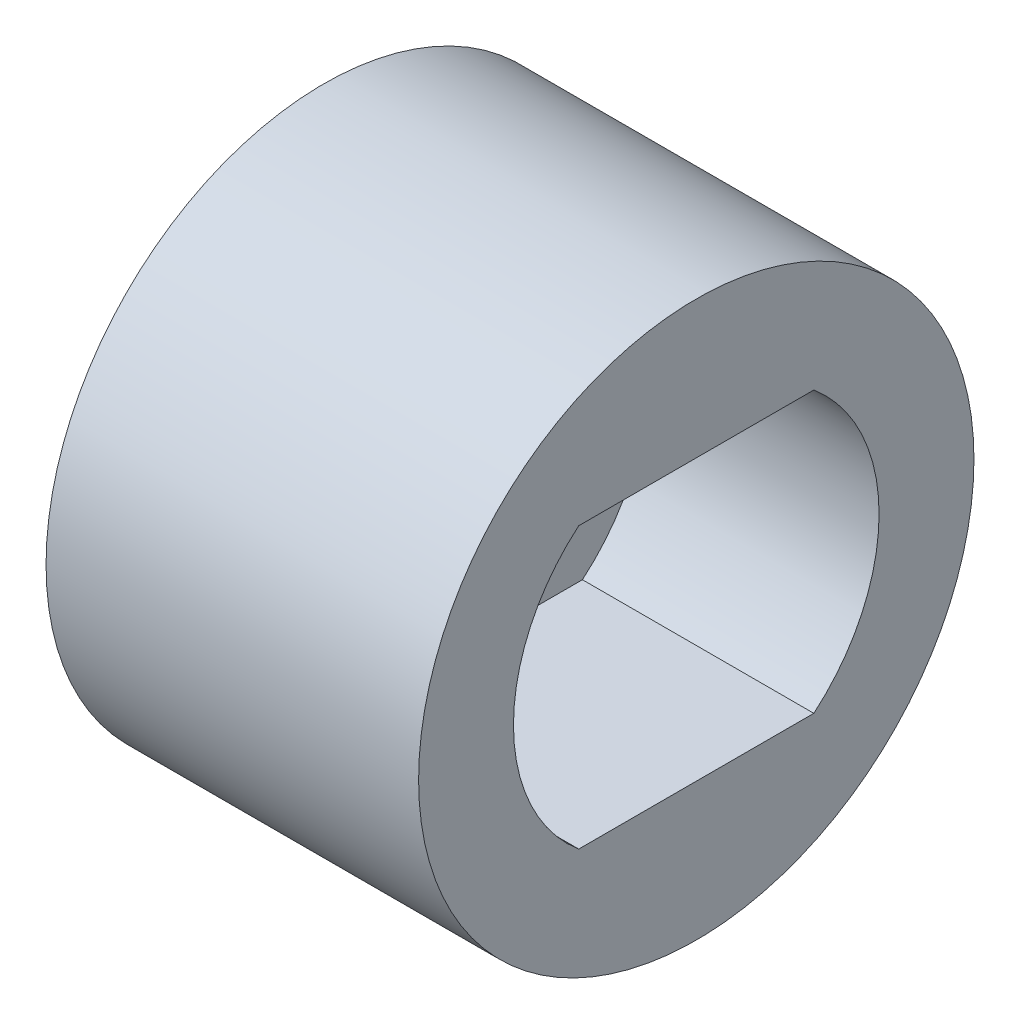
from build123d import *

# Parameters (mm, degrees)
BASPROSKE_W         = 5.1
BASPROSKE_H         = 2.25
TOOTHCUT_DEPTH      = 18.720327311
TEETHCUTS_COUNT     = 41
TEETHCUTS_ANGLE     = 351.219512195
EXTRUDE_START       = 11
SKETCH_1_R          = 12
SKETCH_1_R_2        = 2.5
EXTRUDE_1_DEPTH     = 11
CUT_EXTRUDE_1_REACH = 23.224
CUT_EXTRUDE_START   = 1
SKETCH_1_3_R        = 2.5


with BuildPart() as part:
    # BasProSke → Base-Revolve (revolve)
    with BuildSketch(Plane(origin=(0, 0, 0), x_dir=(1, 0, 0), z_dir=(0, 1, 0))):
        with Locations((2.55, 10.875)):
            Rectangle(BASPROSKE_W, BASPROSKE_H)
    revolve(axis=Axis((-10, 0, 0), (1, 0, 0)))

    # TooCutSke → ToothCut (cut, through all)
    with BuildSketch(Plane(origin=(0, 0, 0), x_dir=(0, 0, -1), z_dir=(1, 0, 0))):
        with BuildLine():
            ThreePointArc((0.61773312, 9.704960121), (0.414250651, 10.304883928), (0.13830881, 10.875120536))
            ThreePointArc((0.13830881, 10.875120536), (0, 10.876), (-0.13830881, 10.875120536))
            ThreePointArc((-0.13830881, 10.875120536), (-0.414250651, 10.304883928), (-0.61773312, 9.704960121))
            ThreePointArc((-0.61773312, 9.704960121), (0, 9.7246), (0.61773312, 9.704960121))
        make_face()
    toothcut = extrude(amount=TOOTHCUT_DEPTH, mode=Mode.SUBTRACT)

    # TeethCuts: ToothCut ×41 about axis
    teethcuts_axis = Axis((-10, 0, 0), (1, 0, 0))
    for i in range(1, TEETHCUTS_COUNT):
        add(toothcut.rotate(teethcuts_axis, i * TEETHCUTS_ANGLE / (TEETHCUTS_COUNT - 1)), mode=Mode.SUBTRACT)

    # 草图1 → 凸台-拉伸1 (add)
    with BuildSketch(Plane(origin=(5.1, 0, 0), x_dir=(0, 0, -1), z_dir=(1, 0, 0)).offset(EXTRUDE_START)):
        Circle(SKETCH_1_R)
        Circle(SKETCH_1_R_2, mode=Mode.SUBTRACT)
    extrude(amount=-EXTRUDE_1_DEPTH)

    # 草图1<3> → 切除-拉伸1 (cut, up to next)
    with BuildSketch(Plane(origin=(5.1, 0, 0), x_dir=(0, 0, -1), z_dir=(1, 0, 0)).offset(CUT_EXTRUDE_START), mode=Mode.PRIVATE) as cut_extrude_1_sk1:
        with BuildLine():
            ThreePointArc((-7.9, 5e-09), (-7.160406949, -3.337449974), (-5.080108267, -6.05))
            Line((-5.080108267, -6.05), (5.080108267, -6.05))
            ThreePointArc((5.080108267, -6.05), (7.160406947, -3.337449977), (7.9, 0))
            ThreePointArc((7.9, 0), (7.160406947, 3.337449977), (5.080108267, 6.05))
            Line((5.080108267, 6.05), (-5.080108267, 6.05))
            ThreePointArc((-5.080108267, 6.05), (-7.160406946, 3.337449979), (-7.9, 5e-09))
        make_face()
        Circle(SKETCH_1_3_R, mode=Mode.SUBTRACT)
    cut_extrude_1_tool1 = extrude(cut_extrude_1_sk1.sketch, amount=CUT_EXTRUDE_1_REACH, mode=Mode.PRIVATE) & part.part
    add(cut_extrude_1_tool1.solids().sort_by_distance((6.1, 3.253376, 6.980028))[0], mode=Mode.SUBTRACT)


solid = part.part
